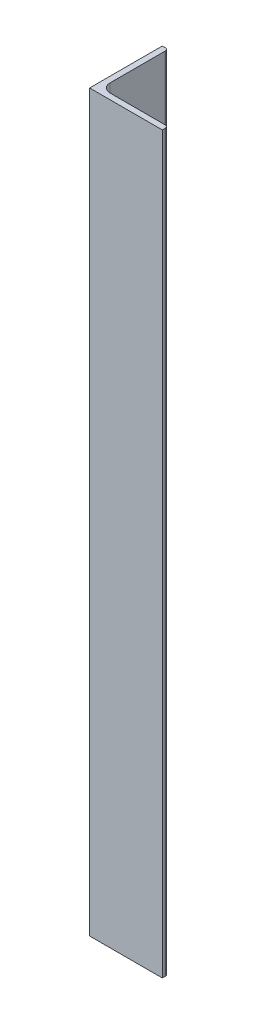
from build123d import *

# Parameters (mm, degrees)
EXTRUDE_1_DEPTH = 758


with BuildPart() as part:
    # Эскиз1 → Бобышка-Вытянуть1 (new body)
    with BuildSketch(Plane(origin=(0, 0, 0), x_dir=(1, 0, 0), z_dir=(0, 1, 0))):
        with BuildLine():
            Line((0, 0), (0, 75))
            Line((0, 75), (3, 75))
            ThreePointArc((3, 75), (5.121320344, 74.121320344), (6, 72))
            Line((6, 72), (6, 15))
            ThreePointArc((6, 15), (8.636038969, 8.636038969), (15, 6))
            Line((15, 6), (72, 6))
            ThreePointArc((72, 6), (74.121320344, 5.121320344), (75, 3))
            Line((75, 3), (75, 0))
            Line((75, 0), (0, 0))
        make_face()
    extrude(amount=EXTRUDE_1_DEPTH)


solid = part.part
